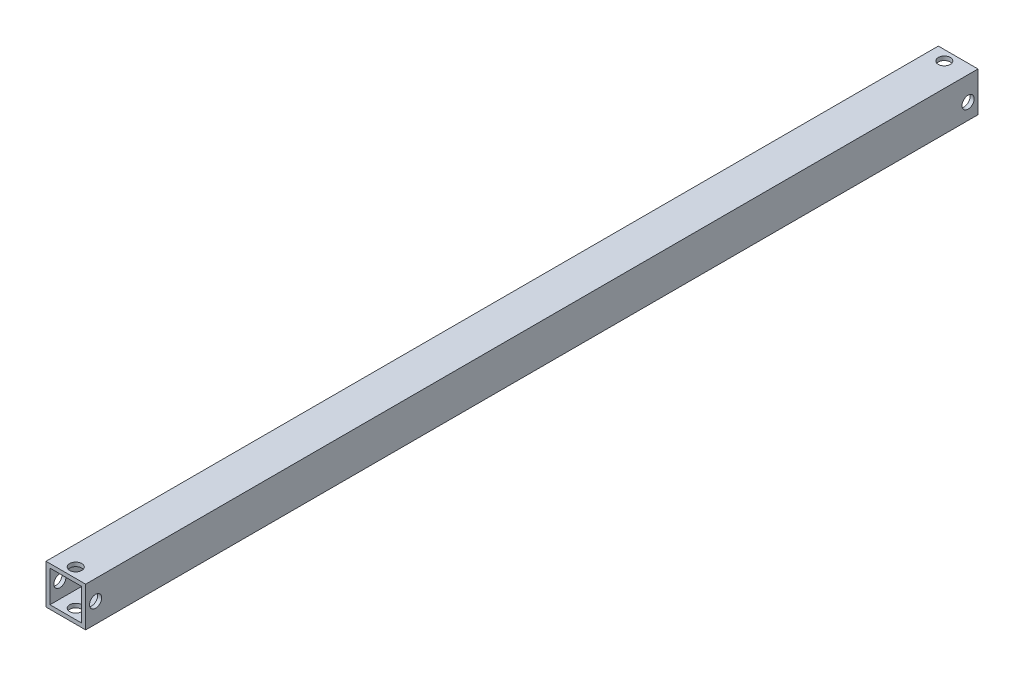
from build123d import *

# Parameters (mm, degrees)
SKETCH1_W           = 40
SKETCH1_H           = 40
SKETCH1_W_2         = 32
SKETCH1_H_2         = 32
BOSS_EXTRUDE1_DEPTH = 900
CUT_EXTRUDE1_DEPTH  = 20
SKETCH3_R           = 6.1
CUT_EXTRUDE2_DEPTH  = 20
SKETCH4_R           = 6.1
CUT_EXTRUDE3_DEPTH  = 20
SKETCH5_R           = 6.1
CUT_EXTRUDE4_DEPTH  = 60
SKETCH6_R           = 6.1
CUT_EXTRUDE5_DEPTH  = 60


with BuildPart() as part:
    # Sketch1 → Boss-Extrude1 (new body)
    with BuildSketch(Plane.XY):
        Rectangle(SKETCH1_W, SKETCH1_H)
        Rectangle(SKETCH1_W_2, SKETCH1_H_2, mode=Mode.SUBTRACT)
    extrude(amount=BOSS_EXTRUDE1_DEPTH)

    # Sketch2 → Cut-Extrude1 (cut)
    with BuildSketch(Plane(origin=(0, 0, 0), x_dir=(-1, 0, 0), z_dir=(0, 0, -1))):
        Polygon((-16, -16), (-16, -20), (20, -20), (20, 16), (16, 16), (16, -16), align=None)
    extrude(amount=-CUT_EXTRUDE1_DEPTH, mode=Mode.SUBTRACT)

    # Sketch3 → Cut-Extrude2 (cut)
    with BuildSketch(Plane.ZY.offset(-16)):
        with Locations((10, -4)):
            Circle(SKETCH3_R)
    extrude(amount=-CUT_EXTRUDE2_DEPTH, mode=Mode.SUBTRACT)

    # Sketch4 → Cut-Extrude3 (cut)
    with BuildSketch(Plane.XZ.offset(-16)):
        with Locations((-4, 10)):
            Circle(SKETCH4_R)
    extrude(amount=-CUT_EXTRUDE3_DEPTH, mode=Mode.SUBTRACT)

    # Sketch5 → Cut-Extrude4 (cut)
    with BuildSketch(Plane.XZ.offset(20)):
        with Locations((0, 890)):
            Circle(SKETCH5_R)
    extrude(amount=-CUT_EXTRUDE4_DEPTH, mode=Mode.SUBTRACT)

    # Sketch6 → Cut-Extrude5 (cut)
    with BuildSketch(Plane.ZY.offset(20)):
        with Locations((890, 0)):
            Circle(SKETCH6_R)
    extrude(amount=-CUT_EXTRUDE5_DEPTH, mode=Mode.SUBTRACT)


solid = part.part
